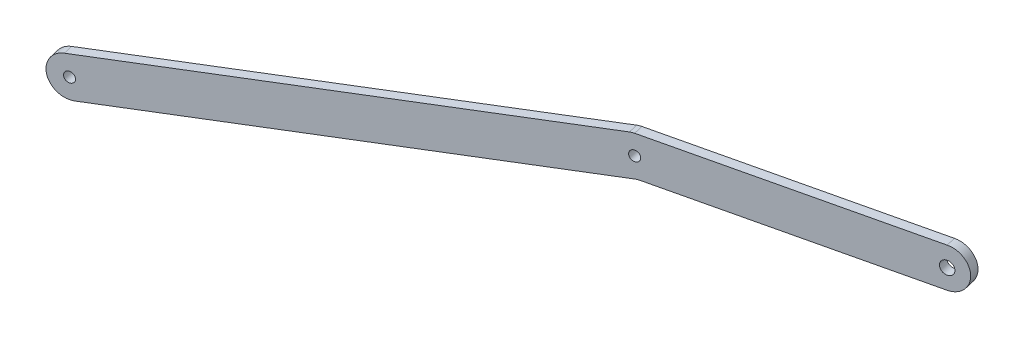
from build123d import *

# Parameters (mm, degrees)
SKETCH1_R           = 12.7
SKETCH1_R_2         = 3.2639
SKETCH1_R_3         = 4.19989
BOSS_EXTRUDE1_DEPTH = 3.175


with BuildPart() as part:
    # Sketch1 → Boss-Extrude1 (new, symmetric)
    # profile 1 of 4: a face of its own
    with BuildSketch(Plane(origin=(0, 0, 0), x_dir=(-0.9735629333039062, 0, 0.22841894601082008), z_dir=(-0.22841894601082008, 1.7517633279464725e-15, -0.9735629333039062))):
        Circle(SKETCH1_R)
        Circle(SKETCH1_R_2, mode=Mode.SUBTRACT)
    # profile 2 of 4: a face of its own
    with BuildSketch(Plane(origin=(0, 0, 0), x_dir=(-0.9735629333039062, 0, 0.22841894601082008), z_dir=(-0.22841894601082008, 1.7517633279464725e-15, -0.9735629333039062))):
        with BuildLine():
            ThreePointArc((-2.817127899, -12.383609748), (-12.383609748, 2.817127899), (2.817127899, 12.383609748))
            Line((2.817127899, 12.383609748), (-302.209540417, 81.773646649))
            ThreePointArc((-302.209540417, 81.773646649), (-295.100250928, 77.311920379), (-292.326668316, 69.390036901))
            ThreePointArc((-292.326668316, 69.390036901), (-314.006924437, 60.40978078), (-305.026668316, 82.090036901))
            Line((-305.026668316, 82.090036901), (-473.718412785, 82.090036901))
            ThreePointArc((-473.718412785, 82.090036901), (-464.738156664, 78.370293022), (-461.018412785, 69.390036901))
            ThreePointArc((-461.018412785, 69.390036901), (-464.738156664, 60.40978078), (-473.718412785, 56.690036901))
            Line((-473.718412785, 56.690036901), (-307.87932985, 56.690036901))
            ThreePointArc((-307.87932985, 56.690036901), (-306.461910329, 56.610691476), (-305.06220195, 56.373646649))
            Line((-305.06220195, 56.373646649), (-2.817127899, -12.383609748))
        make_face()
    # profile 3 of 4: a face of its own
    with BuildSketch(Plane(origin=(0, 0, 0), x_dir=(-0.9735629333039062, 0, 0.22841894601082008), z_dir=(-0.22841894601082008, 1.7517633279464725e-15, -0.9735629333039062))):
        with Locations((-473.718412785, 69.390036901)):
            Circle(SKETCH1_R)
        with Locations((-473.718412785, 69.390036901)):
            Circle(SKETCH1_R_3, mode=Mode.SUBTRACT)
    # profile 4 of 4: a face of its own
    with BuildSketch(Plane(origin=(0, 0, 0), x_dir=(-0.9735629333039062, 0, 0.22841894601082008), z_dir=(-0.22841894601082008, 1.7517633279464725e-15, -0.9735629333039062))):
        with Locations((-305.026668316, 69.390036901)):
            Circle(SKETCH1_R)
        with Locations((-305.026668316, 69.390036901)):
            Circle(SKETCH1_R_2, mode=Mode.SUBTRACT)
    extrude(amount=BOSS_EXTRUDE1_DEPTH, both=True)


solid = part.part
